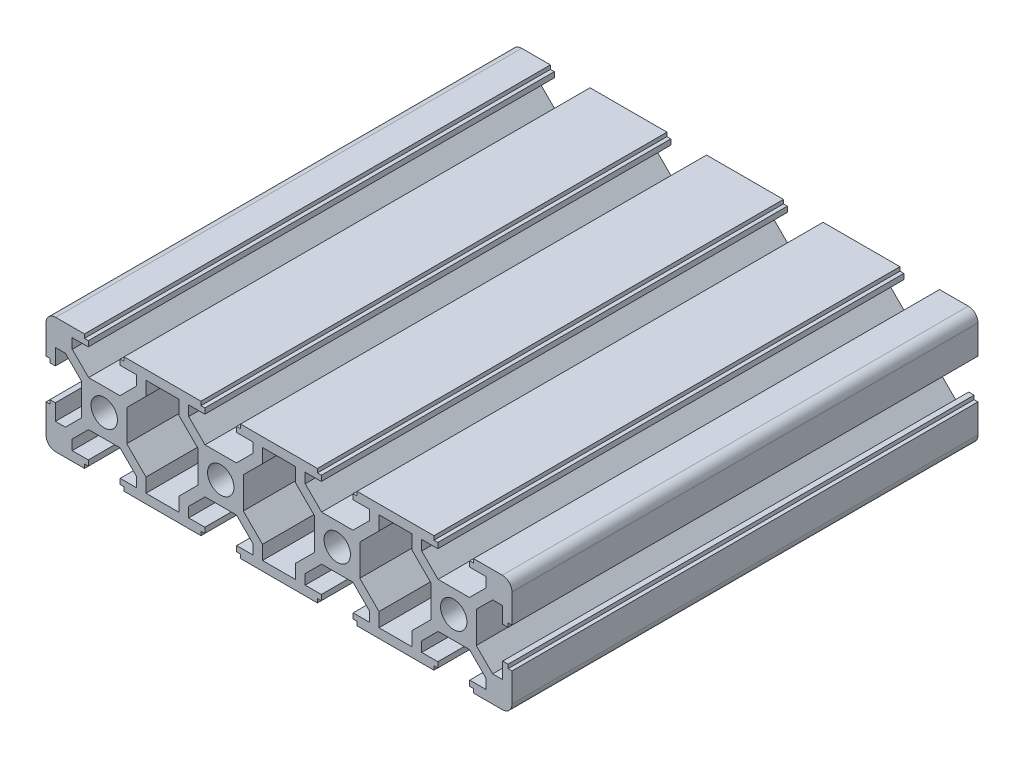
from build123d import *

# Parameters (mm, degrees)
SKETCH_1_R      = 3.4
EXTRUDE_1_DEPTH = 120


with BuildPart() as part:
    # 草图1 → 凸台-拉伸1 (new body)
    with BuildSketch(Plane.XY):
        with BuildLine():
            Line((104, 5.1), (105, 5.1))
            Line((105, 5.1), (105, 12.5))
            ThreePointArc((105, 12.5), (104.267766953, 14.267766953), (102.5, 15))
            Line((102.5, 15), (95.1, 15))
            Line((95.1, 15), (95.1, 14))
            Line((95.1, 14), (94.1, 14))
            Line((94.1, 14), (94.1, 12.6))
            Line((94.1, 12.6), (98.25, 12.6))
            Line((98.25, 12.6), (98.25, 10.014213562))
            Line((98.25, 10.014213562), (94.035786438, 5.8))
            Line((94.035786438, 5.8), (85.964213562, 5.8))
            Line((85.964213562, 5.8), (81.75, 10.014213562))
            Line((81.75, 10.014213562), (81.75, 12.6))
            Line((81.75, 12.6), (85.9, 12.6))
            Line((85.9, 12.6), (85.9, 14))
            Line((85.9, 14), (84.9, 14))
            Line((84.9, 14), (84.9, 15))
            Line((84.9, 15), (65.1, 15))
            Line((65.1, 15), (65.1, 14))
            Line((65.1, 14), (64.1, 14))
            Line((64.1, 14), (64.1, 12.6))
            Line((64.1, 12.6), (68.25, 12.6))
            Line((68.25, 12.6), (68.25, 10.014213562))
            Line((68.25, 10.014213562), (64.035786438, 5.8))
            Line((64.035786438, 5.8), (55.964213562, 5.8))
            Line((55.964213562, 5.8), (51.75, 10.014213562))
            Line((51.75, 10.014213562), (51.75, 12.6))
            Line((51.75, 12.6), (55.9, 12.6))
            Line((55.9, 12.6), (55.9, 14))
            Line((55.9, 14), (54.9, 14))
            Line((54.9, 14), (54.9, 15))
            Line((54.9, 15), (35.1, 15))
            Line((35.1, 15), (35.1, 14))
            Line((35.1, 14), (34.1, 14))
            Line((34.1, 14), (34.1, 12.6))
            Line((34.1, 12.6), (38.25, 12.6))
            Line((38.25, 12.6), (38.25, 10.014213562))
            Line((38.25, 10.014213562), (34.035786438, 5.8))
            Line((34.035786438, 5.8), (25.964213562, 5.8))
            Line((25.964213562, 5.8), (21.75, 10.014213562))
            Line((21.75, 10.014213562), (21.75, 12.6))
            Line((21.75, 12.6), (25.9, 12.6))
            Line((25.9, 12.6), (25.9, 14))
            Line((25.9, 14), (24.9, 14))
            Line((24.9, 14), (24.9, 15))
            Line((24.9, 15), (5.1, 15))
            Line((5.1, 15), (5.1, 14))
            Line((5.1, 14), (4.1, 14))
            Line((4.1, 14), (4.1, 12.6))
            Line((4.1, 12.6), (8.25, 12.6))
            Line((8.25, 12.6), (8.25, 10.014213562))
            Line((8.25, 10.014213562), (4.035786438, 5.8))
            Line((4.035786438, 5.8), (-4.035786438, 5.8))
            Line((-4.035786438, 5.8), (-8.25, 10.014213562))
            Line((-8.25, 10.014213562), (-8.25, 12.6))
            Line((-8.25, 12.6), (-4.1, 12.6))
            Line((-4.1, 12.6), (-4.1, 14))
            Line((-4.1, 14), (-5.1, 14))
            Line((-5.1, 14), (-5.1, 15))
            Line((-5.1, 15), (-12.5, 15))
            ThreePointArc((-12.5, 15), (-14.267766953, 14.267766953), (-15, 12.5))
            Line((-15, 12.5), (-15, 5.1))
            Line((-15, 5.1), (-14, 5.1))
            Line((-14, 5.1), (-14, 4.1))
            Line((-14, 4.1), (-12.6, 4.1))
            Line((-12.6, 4.1), (-12.6, 8.25))
            Line((-12.6, 8.25), (-10.014213562, 8.25))
            Line((-10.014213562, 8.25), (-5.8, 4.035786438))
            Line((-5.8, 4.035786438), (-5.8, -4.035786438))
            Line((-5.8, -4.035786438), (-10.014213562, -8.25))
            Line((-10.014213562, -8.25), (-12.6, -8.25))
            Line((-12.6, -8.25), (-12.6, -4.1))
            Line((-12.6, -4.1), (-14, -4.1))
            Line((-14, -4.1), (-14, -5.1))
            Line((-14, -5.1), (-15, -5.1))
            Line((-15, -5.1), (-15, -12.5))
            ThreePointArc((-15, -12.5), (-14.267766953, -14.267766953), (-12.5, -15))
            Line((-12.5, -15), (-5.1, -15))
            Line((-5.1, -15), (-5.1, -14))
            Line((-5.1, -14), (-4.1, -14))
            Line((-4.1, -14), (-4.1, -12.6))
            Line((-4.1, -12.6), (-8.25, -12.6))
            Line((-8.25, -12.6), (-8.25, -10.014213562))
            Line((-8.25, -10.014213562), (-4.035786438, -5.8))
            Line((-4.035786438, -5.8), (4.035786438, -5.8))
            Line((4.035786438, -5.8), (8.25, -10.014213562))
            Line((8.25, -10.014213562), (8.25, -12.6))
            Line((8.25, -12.6), (4.1, -12.6))
            Line((4.1, -12.6), (4.1, -14))
            Line((4.1, -14), (5.1, -14))
            Line((5.1, -14), (5.1, -15))
            Line((5.1, -15), (24.9, -15))
            Line((24.9, -15), (24.9, -14))
            Line((24.9, -14), (25.9, -14))
            Line((25.9, -14), (25.9, -12.6))
            Line((25.9, -12.6), (21.75, -12.6))
            Line((21.75, -12.6), (21.75, -10.014213562))
            Line((21.75, -10.014213562), (25.964213562, -5.8))
            Line((25.964213562, -5.8), (34.035786438, -5.8))
            Line((34.035786438, -5.8), (38.25, -10.014213562))
            Line((38.25, -10.014213562), (38.25, -12.6))
            Line((38.25, -12.6), (34.1, -12.6))
            Line((34.1, -12.6), (34.1, -14))
            Line((34.1, -14), (35.1, -14))
            Line((35.1, -14), (35.1, -15))
            Line((35.1, -15), (54.9, -15))
            Line((54.9, -15), (54.9, -14))
            Line((54.9, -14), (55.9, -14))
            Line((55.9, -14), (55.9, -12.6))
            Line((55.9, -12.6), (51.75, -12.6))
            Line((51.75, -12.6), (51.75, -10.014213562))
            Line((51.75, -10.014213562), (55.964213562, -5.8))
            Line((55.964213562, -5.8), (64.035786438, -5.8))
            Line((64.035786438, -5.8), (68.25, -10.014213562))
            Line((68.25, -10.014213562), (68.25, -12.6))
            Line((68.25, -12.6), (64.1, -12.6))
            Line((64.1, -12.6), (64.1, -14))
            Line((64.1, -14), (65.1, -14))
            Line((65.1, -14), (65.1, -15))
            Line((65.1, -15), (84.9, -15))
            Line((84.9, -15), (84.9, -14))
            Line((84.9, -14), (85.9, -14))
            Line((85.9, -14), (85.9, -12.6))
            Line((85.9, -12.6), (81.75, -12.6))
            Line((81.75, -12.6), (81.75, -10.014213562))
            Line((81.75, -10.014213562), (85.964213562, -5.8))
            Line((85.964213562, -5.8), (94.035786438, -5.8))
            Line((94.035786438, -5.8), (98.25, -10.014213562))
            Line((98.25, -10.014213562), (98.25, -12.6))
            Line((98.25, -12.6), (94.1, -12.6))
            Line((94.1, -12.6), (94.1, -14))
            Line((94.1, -14), (95.1, -14))
            Line((95.1, -14), (95.1, -15))
            Line((95.1, -15), (102.5, -15))
            ThreePointArc((102.5, -15), (104.267766953, -14.267766953), (105, -12.5))
            Line((105, -12.5), (105, -5.1))
            Line((105, -5.1), (104, -5.1))
            Line((104, -5.1), (104, -4.1))
            Line((104, -4.1), (102.6, -4.1))
            Line((102.6, -4.1), (102.6, -8.25))
            Line((102.6, -8.25), (100.014213562, -8.25))
            Line((100.014213562, -8.25), (95.8, -4.035786438))
            Line((95.8, -4.035786438), (95.8, 4.035786438))
            Line((95.8, 4.035786438), (100.014213562, 8.25))
            Line((100.014213562, 8.25), (102.6, 8.25))
            Line((102.6, 8.25), (102.6, 4.1))
            Line((102.6, 4.1), (104, 4.1))
            Line((104, 4.1), (104, 5.1))
        make_face()
        with Locations((90, 0)):
            Circle(SKETCH_1_R, mode=Mode.SUBTRACT)
        with Locations((60, 0)):
            Circle(SKETCH_1_R, mode=Mode.SUBTRACT)
        with Locations((30, 0)):
            Circle(SKETCH_1_R, mode=Mode.SUBTRACT)
        Circle(SKETCH_1_R, mode=Mode.SUBTRACT)
        Polygon((84.2, -4.035786438), (84.2, 4.035786438), (79.25, 8.985786438), (79.25, 12.6), (70.75, 12.6), (70.75, 8.985786438), (65.8, 4.035786438), (65.8, -4.035786438), (70.75, -8.985786438), (70.75, -12.6), (79.25, -12.6), (79.25, -8.985786438), align=None, mode=Mode.SUBTRACT)
        Polygon((54.2, -4.035786438), (54.2, 4.035786438), (49.25, 8.985786438), (49.25, 12.6), (40.75, 12.6), (40.75, 8.985786438), (35.8, 4.035786438), (35.8, -4.035786438), (40.75, -8.985786438), (40.75, -12.6), (49.25, -12.6), (49.25, -8.985786438), align=None, mode=Mode.SUBTRACT)
        Polygon((24.2, -4.035786438), (24.2, 4.035786438), (19.25, 8.985786438), (19.25, 12.6), (10.75, 12.6), (10.75, 8.985786438), (5.8, 4.035786438), (5.8, -4.035786438), (10.75, -8.985786438), (10.75, -12.6), (19.25, -12.6), (19.25, -8.985786438), align=None, mode=Mode.SUBTRACT)
    extrude(amount=EXTRUDE_1_DEPTH)


solid = part.part
